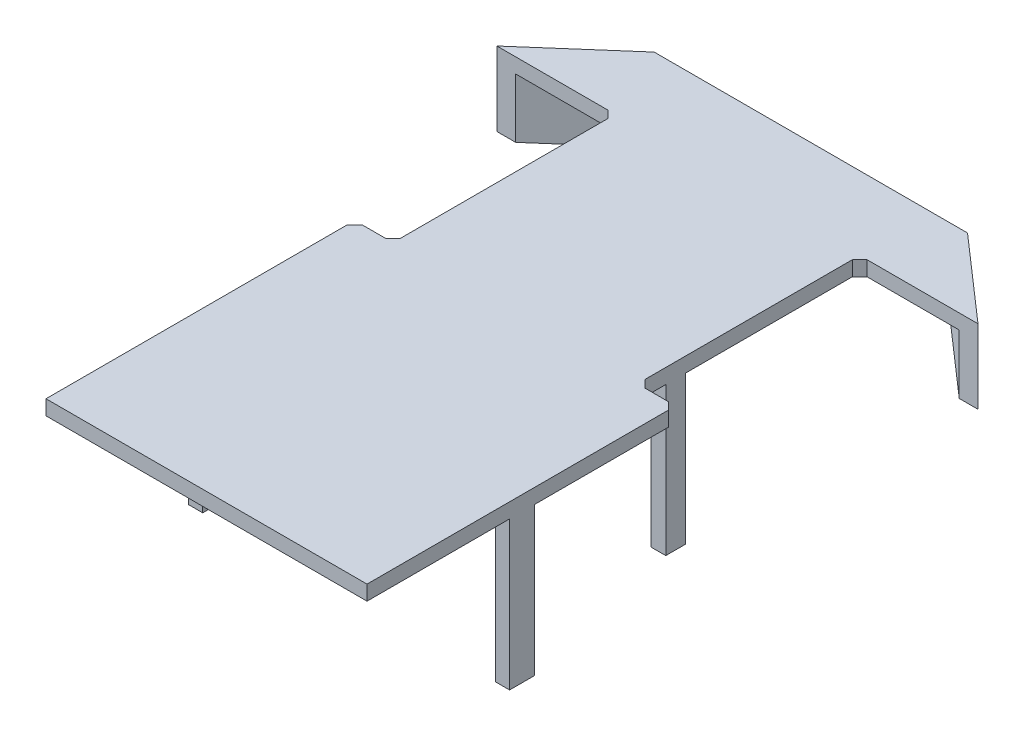
from build123d import *

# Parameters (mm, degrees)
SKETCH1_W             = 6
SKETCH1_H             = 8
BOSS_EXTRUDE1_DEPTH   = 60
SKETCH1_W_2           = 5.75
SKETCH1_H_2           = 10
BOSS_EXTRUDE1_2_DEPTH = 60
BOSS_EXTRUDE1_3_DEPTH = 60
BOSS_EXTRUDE1_4_DEPTH = 60
BOSS_EXTRUDE2_DEPTH   = 6
BOSS_EXTRUDE3_DEPTH   = 24


with BuildPart() as part:
    # Sketch1 → Boss-Extrude1 (new body)
    with BuildSketch(Plane(origin=(0, 0, 0), x_dir=(1, 0, 0), z_dir=(0, 1, 0))):
        with Locations((-46.5, -104.25)):
            Rectangle(SKETCH1_W, SKETCH1_H)
    extrude(amount=BOSS_EXTRUDE1_DEPTH)



with BuildPart() as body_2:
    # Sketch1 → Boss-Extrude1 2 (new body)
    with BuildSketch(Plane(origin=(0, 0, 0), x_dir=(1, 0, 0), z_dir=(0, 1, 0))):
        with Locations((-62.125, -182)):
            Rectangle(SKETCH1_W_2, SKETCH1_H_2)
    extrude(amount=BOSS_EXTRUDE1_2_DEPTH)


with BuildPart() as body_3:
    # Sketch1 → Boss-Extrude1 3 (new body)
    with BuildSketch(Plane(origin=(0, 0, 0), x_dir=(1, 0, 0), z_dir=(0, 1, 0))):
        with Locations((62.125, -182)):
            Rectangle(SKETCH1_W_2, SKETCH1_H_2)
    extrude(amount=BOSS_EXTRUDE1_3_DEPTH)


with BuildPart() as body_4:
    # Sketch1 → Boss-Extrude1 4 (new body)
    with BuildSketch(Plane(origin=(0, 0, 0), x_dir=(1, 0, 0), z_dir=(0, 1, 0))):
        with Locations((46.5, -104.25)):
            Rectangle(SKETCH1_W, SKETCH1_H)
    extrude(amount=BOSS_EXTRUDE1_4_DEPTH)


with BuildPart() as part_1:
    add(part.part)

    add(body_2.part)  # Boss-Extrude2 merges body 2

    add(body_3.part)  # Boss-Extrude2 merges body 3

    add(body_4.part)  # Boss-Extrude2 merges body 4
    # Sketch2 → Boss-Extrude2 (add)
    with BuildSketch(Plane(origin=(0, 60, 0), x_dir=(1, 0, 0), z_dir=(0, 1, 0))):
        Polygon((-52.5, -119.720396317), (-62, -119.720396317), (-65, -122.720396317), (-65, -244.720396317), (65, -244.720396317), (65, -122.720396317), (62, -119.720396317), (52.5, -119.720396317), (49.5, -116.720396317), (49.5, -32.720396317), (52.5, -29.720396317), (97.407038705, -29.720396317), (63.440871486, 0), (-63.440871486, 0), (-97.407038705, -29.720396317), (-52.5, -29.720396317), (-49.5, -32.720396317), (-49.5, -116.720396317), align=None)
    extrude(amount=BOSS_EXTRUDE2_DEPTH)

    # Sketch4 → Boss-Extrude3 (add)
    with BuildSketch(Plane.XZ.offset(-60)):
        Polygon((89.81407741, 29.720396317), (61.562195905, 5), (-61.562195905, 5), (-89.81407741, 29.720396317), (-97.407038705, 29.720396317), (-63.440871486, 0), (63.440871486, 0), (97.407038705, 29.720396317), align=None)
    extrude(amount=BOSS_EXTRUDE3_DEPTH)


solid = part_1.part
